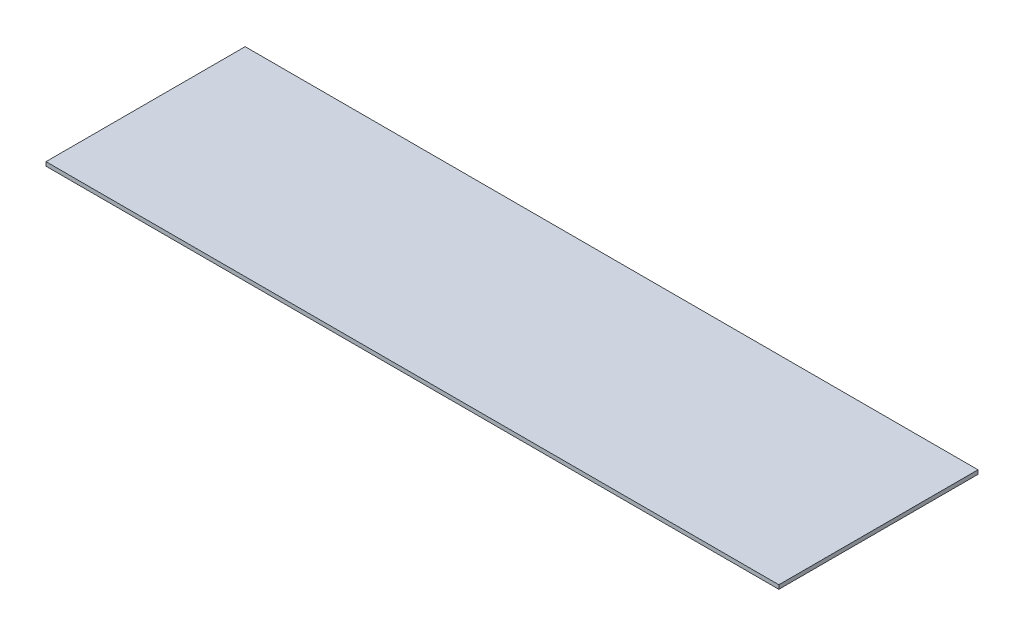
from build123d import *

# Parameters (mm, degrees)
SKETCH1_W           = 920
SKETCH1_H           = 250
BOSS_EXTRUDE1_DEPTH = 5


with BuildPart() as part:
    # Sketch1 → Boss-Extrude1 (new body)
    with BuildSketch(Plane(origin=(0, 0, 0), x_dir=(1, 0, 0), z_dir=(0, 1, 0))):
        Rectangle(SKETCH1_W, SKETCH1_H)
    extrude(amount=BOSS_EXTRUDE1_DEPTH)


solid = part.part
